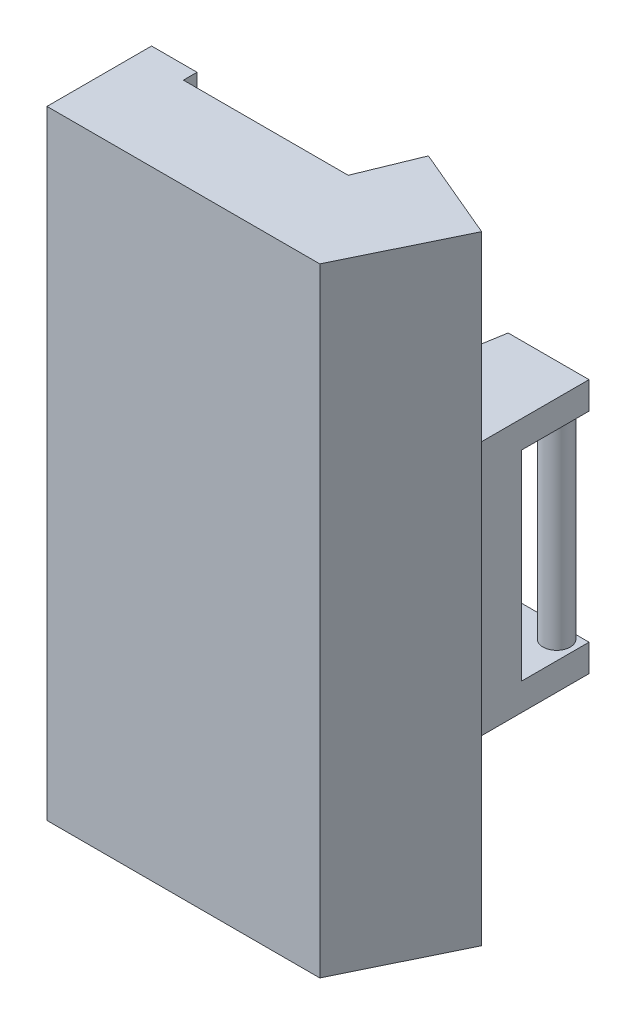
from build123d import *

# Parameters (mm, degrees)
BOSS_EXTRU_1_DEPTH      = 11
BOSS_EXTRU_1_DEPTH_BACK = 11
ESQUISSE1_R             = 1.5
BOSS_EXTRU_3_DEPTH      = 3
BOSS_EXTRU_3_DEPTH_BACK = 25
BOSS_EXTRU_4_DEPTH      = 3
BOSS_EXTRU_5_DEPTH      = 3
ESQUISSE5_W             = 5
ESQUISSE5_H             = 2
ENL_V_MAT_EXTRU_1_DEPTH = 39
ESQUISSE6_W             = 5
ESQUISSE6_H             = 1.5
BOSS_EXTRU_6_DEPTH      = 28
BOSS_EXTRU_7_DEPTH      = 20
BOSS_EXTRU_7_DEPTH_BACK = 48


with BuildPart() as part:
    # Esquisse1 → Boss.-Extru.1 (new, two sides: drawn at the far end of the back side and taken through both)
    with BuildSketch(Plane(origin=(0, 0, 0), x_dir=(1, 0, 0), z_dir=(0, 1, 0)).offset(-BOSS_EXTRU_1_DEPTH_BACK)):
        with Locations(Location((0, 0, 0), (0, 0, 270))):
            Circle(ESQUISSE1_R)
    extrude(amount=BOSS_EXTRU_1_DEPTH + BOSS_EXTRU_1_DEPTH_BACK)



with BuildPart() as body_2:
    # Esquisse2 → Boss.-Extru.3 (new, two sides: drawn at the far end of the back side and taken through both)
    with BuildSketch(Plane.XZ.offset(11).offset(-BOSS_EXTRU_3_DEPTH_BACK)):
        Polygon((2.061683226, 10.308952687), (-3.759613912, 22.279872949), (-33.759613912, 22.279872949), (-33.759613912, 12.279872949), (-28.759613912, 12.279872949), (-28.759613912, 10.279872949), (-23.759613912, 10.279872949), (-23.759613912, 12.279872949), (-10.635382522, 12.279872949), (-8.075859571, 6.021220419), (2.061683226, 5.904476344), align=None)
    extrude(amount=BOSS_EXTRU_3_DEPTH + BOSS_EXTRU_3_DEPTH_BACK)


with BuildPart() as part_1:
    add(part.part)

    add(body_2.part)  # Boss.-Extru.4 merges body 2
    # Esquisse3 → Boss.-Extru.4 (add)
    with BuildSketch(Plane.XZ.offset(11)):
        Polygon((0, -1.5), (-6.831858839, -1.5), (-8.075859571, 6.021220419), (2.061683226, 5.904476344), (2.061683226, -1.5), align=None)
    extrude(amount=BOSS_EXTRU_4_DEPTH)

    # Esquisse4 → Boss.-Extru.5 (add)
    with BuildSketch(Plane(origin=(0, 11, 0), x_dir=(1, 0, 0), z_dir=(0, 1, 0))):
        Polygon((2.061683226, 1.5), (-6.831858839, 1.5), (-8.075859571, -6.021220419), (2.061683226, -5.904476344), align=None)
    extrude(amount=BOSS_EXTRU_5_DEPTH)

    # Esquisse5 → Enlèv. mat.-Extru.1 (cut)
    with BuildSketch(Plane(origin=(0, 14, 0), x_dir=(1, 0, 0), z_dir=(0, 1, 0))):
        with Locations((-26.259613912, -11.279872949)):
            Rectangle(ESQUISSE5_W, ESQUISSE5_H)
    extrude(amount=-ENL_V_MAT_EXTRU_1_DEPTH, mode=Mode.SUBTRACT)

    # Esquisse6 → Boss.-Extru.6 (add)
    with BuildSketch(Plane(origin=(0, 14, 0), x_dir=(1, 0, 0), z_dir=(0, 1, 0))):
        with Locations((-31.259613912, -11.529872949)):
            Rectangle(ESQUISSE6_W, ESQUISSE6_H)
    extrude(amount=-BOSS_EXTRU_6_DEPTH)

    # Esquisse7 → Boss.-Extru.7 (add, two sides: drawn at the far end of the back side and taken through both)
    with BuildSketch(Plane.XZ.offset(14).offset(-BOSS_EXTRU_7_DEPTH_BACK)):
        Polygon((2.061683226, 10.308952687), (-8.075859571, 6.021220419), (-10.635382522, 12.279872949), (-28.759613912, 12.279872949), (-28.759613912, 10.779872949), (-33.759613912, 10.779872949), (-33.759613912, 22.279872949), (-3.759613912, 22.279872949), align=None)
    extrude(amount=BOSS_EXTRU_7_DEPTH + BOSS_EXTRU_7_DEPTH_BACK)


solid = part_1.part
